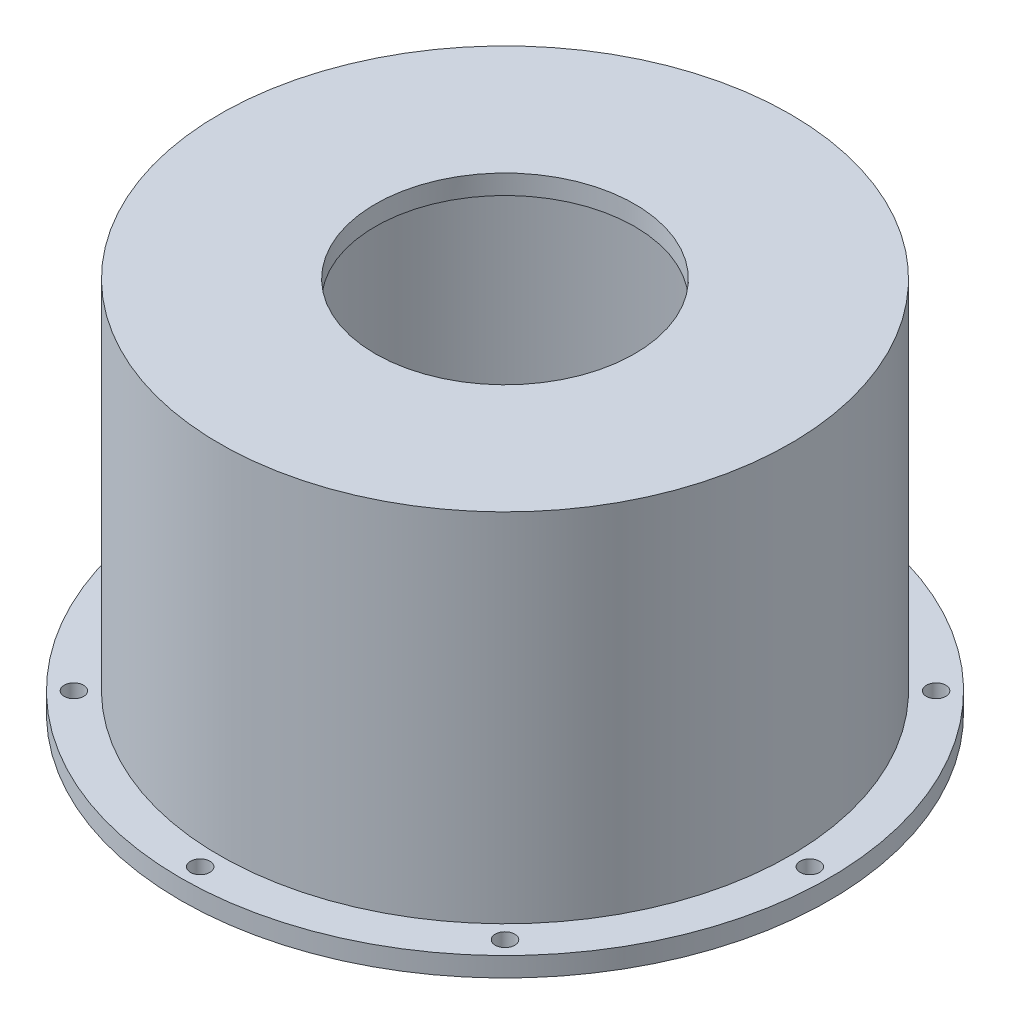
from build123d import *

# Parameters (mm, degrees)
SKETCH2_R          = 1.5
CUT_EXTRUDE1_DEPTH = 90.582364336
SKETCH3_R          = 20
CUT_EXTRUDE2_DEPTH = 92.454906921


with BuildPart() as part:
    # Sketch1 → Revolve1 (revolve)
    with BuildSketch(Plane.XY, mode=Mode.PRIVATE) as revolve1_sk:
        Polygon((0, 58), (44, 58), (44, 3), (50, 3), (50, 0), (41.5, 0), (41.5, 55), (0, 55), align=None)
    revolve(revolve1_sk.sketch.rotate(Axis((0, 0, 0), (0, 1, 0)), 90), axis=Axis((0, 0, 0), (0, 1, 0)))

    # Sketch2 → Cut-Extrude1 (cut, through all)
    with BuildSketch(Plane(origin=(0, 3, 0), x_dir=(1, 0, 0), z_dir=(0, 1, 0))):
        with Locations(Location((0, -47, 0), (0, 0, 270))):
            Circle(SKETCH2_R)
        with Locations(Location((-33.234018716, -33.234018716, 0), (0, 0, 270))):
            Circle(SKETCH2_R)
        with Locations(Location((-47, 0, 0), (0, 0, 270))):
            Circle(SKETCH2_R)
        with Locations(Location((-33.234018716, 33.234018716, 0), (0, 0, 270))):
            Circle(SKETCH2_R)
        with Locations(Location((0, 47, 0), (0, 0, 270))):
            Circle(SKETCH2_R)
        with Locations(Location((33.234018716, 33.234018716, 0), (0, 0, 270))):
            Circle(SKETCH2_R)
        with Locations(Location((47, 0, 0), (0, 0, 270))):
            Circle(SKETCH2_R)
        with Locations(Location((33.234018716, -33.234018716, 0), (0, 0, 270))):
            Circle(SKETCH2_R)
    extrude(amount=-CUT_EXTRUDE1_DEPTH, mode=Mode.SUBTRACT)

    # Sketch3 → Cut-Extrude2 (cut, through all)
    with BuildSketch(Plane(origin=(0, 58, 0), x_dir=(1, 0, 0), z_dir=(0, 1, 0))):
        with Locations(Location((0, 0, 0), (0, 0, 270))):
            Circle(SKETCH3_R)
    extrude(amount=-CUT_EXTRUDE2_DEPTH, mode=Mode.SUBTRACT)


solid = part.part
